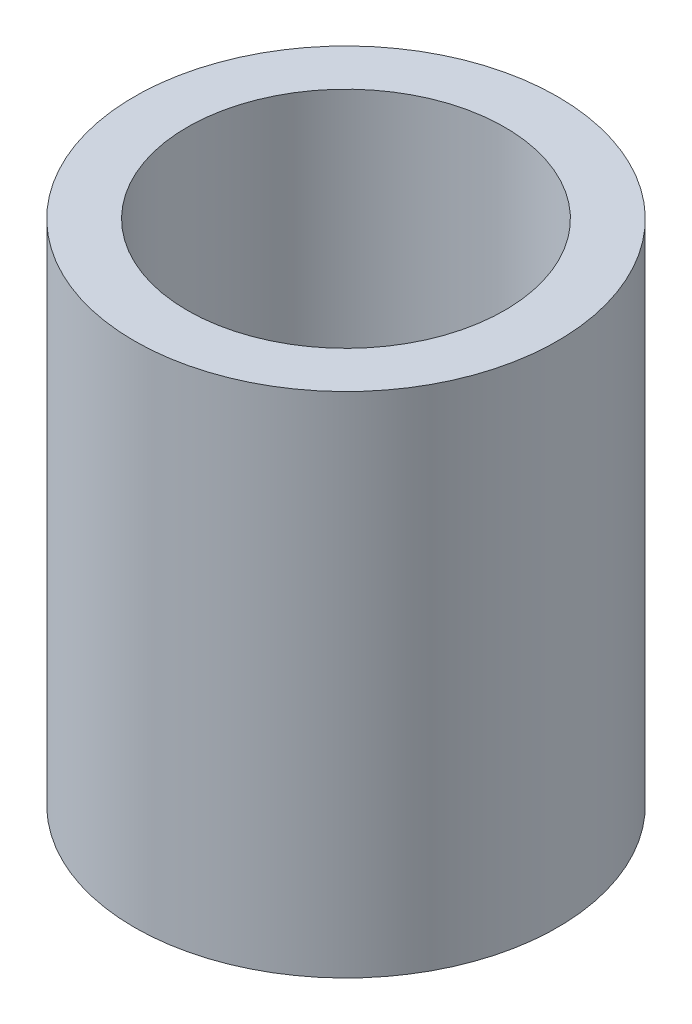
from build123d import *

# Parameters (mm, degrees)
SKETCH1_R           = 2
SKETCH1_R_2         = 1.5
BOSS_EXTRUDE1_DEPTH = 4.8


with BuildPart() as part:
    # Sketch1 → Boss-Extrude1 (new body)
    with BuildSketch(Plane(origin=(0, 0, 0), x_dir=(1, 0, 0), z_dir=(0, 1, 0))):
        with Locations(Location((0, 0, 0), (0, 0, 270))):
            Circle(SKETCH1_R)
        with Locations(Location((0, 0, 0), (0, 0, 270))):
            Circle(SKETCH1_R_2, mode=Mode.SUBTRACT)
    extrude(amount=BOSS_EXTRUDE1_DEPTH)


solid = part.part
